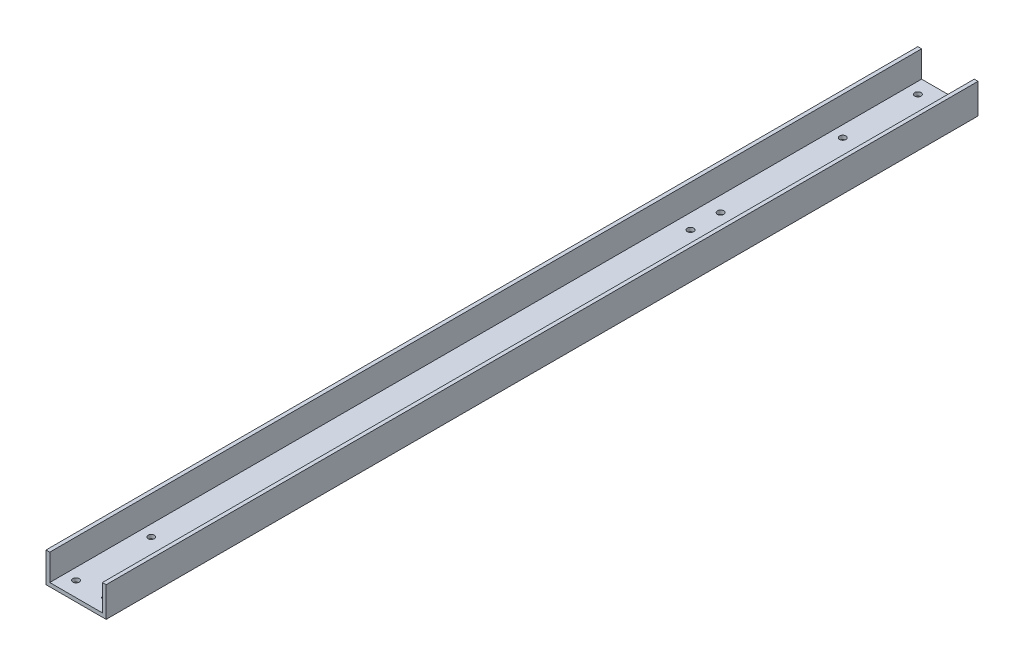
from build123d import *

# Parameters (mm, degrees)
EXTRUDE_F_DEPTH    = 736.6
CUT_EXTRUDE1_REACH = 740.684
SKETCH2_R          = 2.667
CUT_EXTRUDE2_REACH = 740.684
SKETCH3_R          = 2.667


with BuildPart() as part:
    # Sketch1 → Extrude f (new body)
    with BuildSketch(Plane.XY):
        Polygon((3.175, 3.175), (3.175, 25.4), (0, 25.4), (0, 0), (50.8, 0), (50.8, 25.4), (47.625, 25.4), (47.625, 3.175), align=None)
    extrude(amount=EXTRUDE_F_DEPTH)

    # Sketch2 → Cut-Extrude1 (cut, up to next)
    with BuildSketch(Plane(origin=(0, 3.175, 0), x_dir=(1, 0, 0), z_dir=(0, 1, 0)), mode=Mode.PRIVATE) as cut_extrude1_sk1:
        with Locations(Location((12.7, -723.9, 0), (0, 0, 270))):
            Circle(SKETCH2_R)
    cut_extrude1_tool1 = extrude(cut_extrude1_sk1.sketch, amount=-CUT_EXTRUDE1_REACH, mode=Mode.PRIVATE) & part.part
    # Sketch2 → Cut-Extrude1 (cut, up to next)
    with BuildSketch(Plane(origin=(0, 3.175, 0), x_dir=(1, 0, 0), z_dir=(0, 1, 0)), mode=Mode.PRIVATE) as cut_extrude1_sk2:
        with Locations(Location((12.7, -660.4, 0), (0, 0, 270))):
            Circle(SKETCH2_R)
    cut_extrude1_tool2 = extrude(cut_extrude1_sk2.sketch, amount=-CUT_EXTRUDE1_REACH, mode=Mode.PRIVATE) & part.part
    # Sketch2 → Cut-Extrude1 (cut, up to next)
    with BuildSketch(Plane(origin=(0, 3.175, 0), x_dir=(1, 0, 0), z_dir=(0, 1, 0)), mode=Mode.PRIVATE) as cut_extrude1_sk3:
        with Locations(Location((38.1, -660.4, 0), (0, 0, 270))):
            Circle(SKETCH2_R)
    cut_extrude1_tool3 = extrude(cut_extrude1_sk3.sketch, amount=-CUT_EXTRUDE1_REACH, mode=Mode.PRIVATE) & part.part
    # Sketch2 → Cut-Extrude1 (cut, up to next)
    with BuildSketch(Plane(origin=(0, 3.175, 0), x_dir=(1, 0, 0), z_dir=(0, 1, 0)), mode=Mode.PRIVATE) as cut_extrude1_sk4:
        with Locations(Location((38.1, -723.9, 0), (0, 0, 270))):
            Circle(SKETCH2_R)
    cut_extrude1_tool4 = extrude(cut_extrude1_sk4.sketch, amount=-CUT_EXTRUDE1_REACH, mode=Mode.PRIVATE) & part.part
    # Sketch2 → Cut-Extrude1 (cut, up to next)
    with BuildSketch(Plane(origin=(0, 3.175, 0), x_dir=(1, 0, 0), z_dir=(0, 1, 0)), mode=Mode.PRIVATE) as cut_extrude1_sk5:
        with Locations(Location((38.1, -12.7, 0), (0, 0, 270))):
            Circle(SKETCH2_R)
    cut_extrude1_tool5 = extrude(cut_extrude1_sk5.sketch, amount=-CUT_EXTRUDE1_REACH, mode=Mode.PRIVATE) & part.part
    # Sketch2 → Cut-Extrude1 (cut, up to next)
    with BuildSketch(Plane(origin=(0, 3.175, 0), x_dir=(1, 0, 0), z_dir=(0, 1, 0)), mode=Mode.PRIVATE) as cut_extrude1_sk6:
        with Locations(Location((38.1, -76.2, 0), (0, 0, 270))):
            Circle(SKETCH2_R)
    cut_extrude1_tool6 = extrude(cut_extrude1_sk6.sketch, amount=-CUT_EXTRUDE1_REACH, mode=Mode.PRIVATE) & part.part
    # Sketch2 → Cut-Extrude1 (cut, up to next)
    with BuildSketch(Plane(origin=(0, 3.175, 0), x_dir=(1, 0, 0), z_dir=(0, 1, 0)), mode=Mode.PRIVATE) as cut_extrude1_sk7:
        with Locations(Location((12.7, -12.7, 0), (0, 0, 270))):
            Circle(SKETCH2_R)
    cut_extrude1_tool7 = extrude(cut_extrude1_sk7.sketch, amount=-CUT_EXTRUDE1_REACH, mode=Mode.PRIVATE) & part.part
    # Sketch2 → Cut-Extrude1 (cut, up to next)
    with BuildSketch(Plane(origin=(0, 3.175, 0), x_dir=(1, 0, 0), z_dir=(0, 1, 0)), mode=Mode.PRIVATE) as cut_extrude1_sk8:
        with Locations(Location((12.7, -76.2, 0), (0, 0, 270))):
            Circle(SKETCH2_R)
    cut_extrude1_tool8 = extrude(cut_extrude1_sk8.sketch, amount=-CUT_EXTRUDE1_REACH, mode=Mode.PRIVATE) & part.part
    add(cut_extrude1_tool1.solids().sort_by_distance((12.7, 3.175, 723.9))[0], mode=Mode.SUBTRACT)
    add(cut_extrude1_tool2.solids().sort_by_distance((12.7, 3.175, 660.4))[0], mode=Mode.SUBTRACT)
    add(cut_extrude1_tool3.solids().sort_by_distance((38.1, 3.175, 660.4))[0], mode=Mode.SUBTRACT)
    add(cut_extrude1_tool4.solids().sort_by_distance((38.1, 3.175, 723.9))[0], mode=Mode.SUBTRACT)
    add(cut_extrude1_tool5.solids().sort_by_distance((38.1, 3.175, 12.7))[0], mode=Mode.SUBTRACT)
    add(cut_extrude1_tool6.solids().sort_by_distance((38.1, 3.175, 76.2))[0], mode=Mode.SUBTRACT)
    add(cut_extrude1_tool7.solids().sort_by_distance((12.7, 3.175, 12.7))[0], mode=Mode.SUBTRACT)
    add(cut_extrude1_tool8.solids().sort_by_distance((12.7, 3.175, 76.2))[0], mode=Mode.SUBTRACT)

    # Sketch3 → Cut-Extrude2 (cut, up to next)
    with BuildSketch(Plane(origin=(0, 3.175, 0), x_dir=(1, 0, 0), z_dir=(0, 1, 0)), mode=Mode.PRIVATE) as cut_extrude2_sk1:
        with Locations(Location((34.925, -207.9371, 0), (0, 0, 270))):
            Circle(SKETCH3_R)
    cut_extrude2_tool1 = extrude(cut_extrude2_sk1.sketch, amount=-CUT_EXTRUDE2_REACH, mode=Mode.PRIVATE) & part.part
    # Sketch3 → Cut-Extrude2 (cut, up to next)
    with BuildSketch(Plane(origin=(0, 3.175, 0), x_dir=(1, 0, 0), z_dir=(0, 1, 0)), mode=Mode.PRIVATE) as cut_extrude2_sk2:
        with Locations(Location((15.875, -207.9371, 0), (0, 0, 270))):
            Circle(SKETCH3_R)
    cut_extrude2_tool2 = extrude(cut_extrude2_sk2.sketch, amount=-CUT_EXTRUDE2_REACH, mode=Mode.PRIVATE) & part.part
    # Sketch3 → Cut-Extrude2 (cut, up to next)
    with BuildSketch(Plane(origin=(0, 3.175, 0), x_dir=(1, 0, 0), z_dir=(0, 1, 0)), mode=Mode.PRIVATE) as cut_extrude2_sk3:
        with Locations(Location((34.925, -182.5371, 0), (0, 0, 270))):
            Circle(SKETCH3_R)
    cut_extrude2_tool3 = extrude(cut_extrude2_sk3.sketch, amount=-CUT_EXTRUDE2_REACH, mode=Mode.PRIVATE) & part.part
    # Sketch3 → Cut-Extrude2 (cut, up to next)
    with BuildSketch(Plane(origin=(0, 3.175, 0), x_dir=(1, 0, 0), z_dir=(0, 1, 0)), mode=Mode.PRIVATE) as cut_extrude2_sk4:
        with Locations(Location((15.875, -182.5371, 0), (0, 0, 270))):
            Circle(SKETCH3_R)
    cut_extrude2_tool4 = extrude(cut_extrude2_sk4.sketch, amount=-CUT_EXTRUDE2_REACH, mode=Mode.PRIVATE) & part.part
    add(cut_extrude2_tool1.solids().sort_by_distance((34.925, 3.175, 207.9371))[0], mode=Mode.SUBTRACT)
    add(cut_extrude2_tool2.solids().sort_by_distance((15.875, 3.175, 207.9371))[0], mode=Mode.SUBTRACT)
    add(cut_extrude2_tool3.solids().sort_by_distance((34.925, 3.175, 182.5371))[0], mode=Mode.SUBTRACT)
    add(cut_extrude2_tool4.solids().sort_by_distance((15.875, 3.175, 182.5371))[0], mode=Mode.SUBTRACT)


solid = part.part
